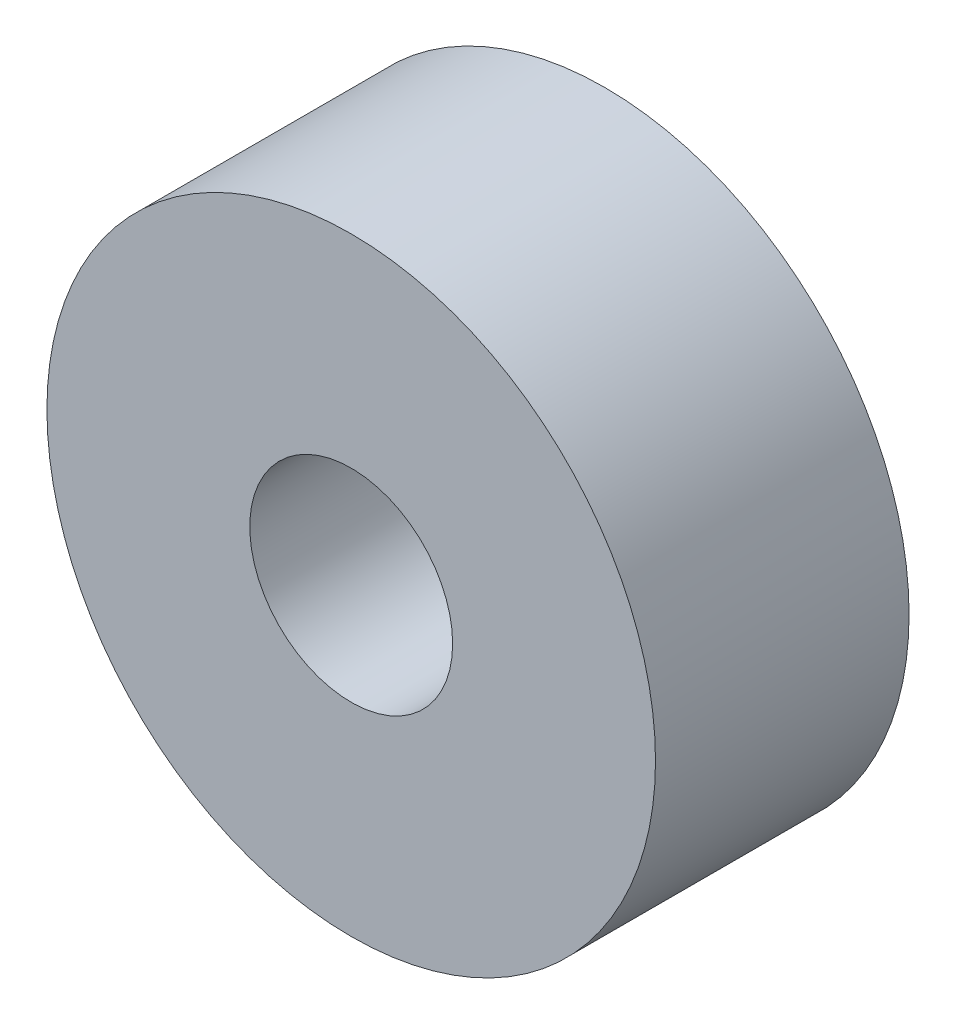
from build123d import *

# Parameters (mm, degrees)
ESQUISSE1_R        = 6
ESQUISSE1_R_2      = 2
BOSS_EXTRU_1_DEPTH = 5


with BuildPart() as part:
    # Esquisse1 → Boss.-Extru.1 (new body)
    with BuildSketch(Plane.XY):
        Circle(ESQUISSE1_R)
        Circle(ESQUISSE1_R_2, mode=Mode.SUBTRACT)
    extrude(amount=BOSS_EXTRU_1_DEPTH)


solid = part.part
